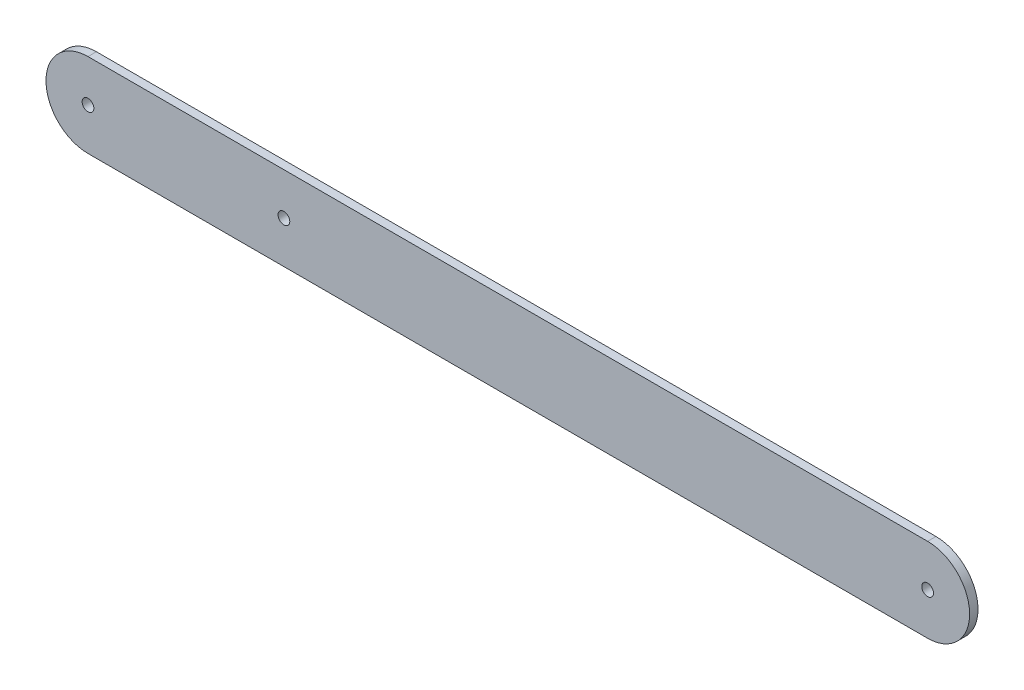
from build123d import *

# Parameters (mm, degrees)
ESQUISSE1_R             = 2.1
BOSS_EXTRU_1_DEPTH      = 3
ESQUISSE2_R             = 2.1
ENL_V_MAT_EXTRU_1_DEPTH = 166.707573756


with BuildPart() as part:
    # Esquisse1 → Boss.-Extru.1 (new body)
    with BuildSketch(Plane.XY):
        with BuildLine():
            Line((0, 15), (150, 15))
            ThreePointArc((150, 15), (165, 0), (150, -15))
            Line((150, -15), (0, -15))
            Line((0, -15), (0, 15))
        make_face()
        with Locations((150, 0)):
            Circle(ESQUISSE1_R, mode=Mode.SUBTRACT)
    extrude(amount=BOSS_EXTRU_1_DEPTH)

    # Symétrie1: part across plane


with BuildPart() as part_1:
    add(part.part)
    add(part.part.mirror(Plane(origin=(0, 15, 3), x_dir=(0, 0, 1), z_dir=(1, 0, 0))))

    # Esquisse2 → Enlèv. mat.-Extru.1 (cut, through all)
    with BuildSketch(Plane.XY.offset(3)):
        with Locations((-80, 0)):
            Circle(ESQUISSE2_R)
    extrude(amount=-ENL_V_MAT_EXTRU_1_DEPTH, mode=Mode.SUBTRACT)


solid = part_1.part
